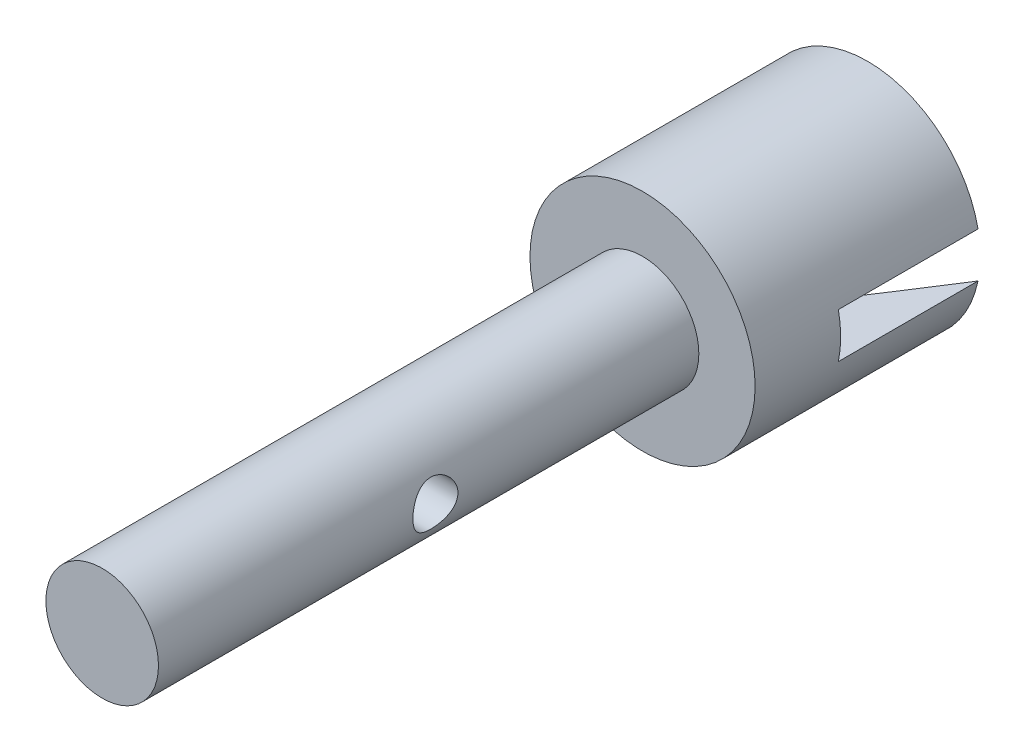
from build123d import *

# Parameters (mm, degrees)
SKETCH1_R           = 5
BOSS_EXTRUDE1_DEPTH = 10
SKETCH2_R           = 2.5
BOSS_EXTRUDE2_DEPTH = 24
SKETCH3_R           = 3
CUT_EXTRUDE1_DEPTH  = 5.2
CHAMFER1_SIZE       = 3.2
CHAMFER1_SIZE2      = 1.999581926
SKETCH7_W           = 12.152582876
SKETCH7_H           = 2
CUT_EXTRUDE2_DEPTH  = 6.2
CUT_EXTRUDE3_REACH  = 37.175
SKETCH8_R           = 1


with BuildPart() as part:
    # Sketch1 → Boss-Extrude1 (new body)
    with BuildSketch(Plane.XY):
        Circle(SKETCH1_R)
    extrude(amount=BOSS_EXTRUDE1_DEPTH)

    # Sketch2 → Boss-Extrude2 (add)
    with BuildSketch(Plane.XY.offset(10)):
        Circle(SKETCH2_R)
    extrude(amount=BOSS_EXTRUDE2_DEPTH)

    # Sketch3 → Cut-Extrude1 (cut)
    with BuildSketch(Plane(origin=(0, 0, 0), x_dir=(-1, 0, 0), z_dir=(0, 0, -1))):
        Circle(SKETCH3_R)
    extrude(amount=-CUT_EXTRUDE1_DEPTH, mode=Mode.SUBTRACT)

    # Chamfer1
    chamfer1_edges = [part.edges().sort_by_distance(p)[0] for p in [
        (3, 0, 0),
    ]]
    chamfer1_side = [part.faces().sort_by_distance(p)[0] for p in [
        (3, 0, 2.6),
    ]]
    chamfer(chamfer1_edges, length=CHAMFER1_SIZE, length2=CHAMFER1_SIZE2, reference=chamfer1_side[0])

    # Sketch6 → Cut-Revolve2 (revolve, cut)
    with BuildSketch(Plane(origin=(0, 0, 5.2), x_dir=(-1, 0, 0), z_dir=(0, 0, -1))):
        with BuildLine():
            Line((3, 0), (-3, 0))
            ThreePointArc((-3, 0), (0, -3), (3, 0))
        make_face()
    revolve(axis=Axis((-3, 0, 5.2), (1, 0, 0)), mode=Mode.SUBTRACT)

    # Sketch7 → Cut-Extrude2 (cut)
    with BuildSketch(Plane.XY):
        Rectangle(SKETCH7_W, SKETCH7_H)
    extrude(amount=CUT_EXTRUDE2_DEPTH, mode=Mode.SUBTRACT)

    # Sketch8 → Cut-Extrude3 (cut, up to next)
    with BuildSketch(Plane(origin=(2.5, 0, 0), x_dir=(0, 0, -1), z_dir=(1, 0, 0)), mode=Mode.PRIVATE) as cut_extrude3_sk1:
        with Locations((-21.7, 0)):
            Circle(SKETCH8_R)
    cut_extrude3_tool1 = extrude(cut_extrude3_sk1.sketch, amount=-CUT_EXTRUDE3_REACH, mode=Mode.PRIVATE) & part.part
    add(cut_extrude3_tool1.solids().sort_by_distance((2.5, 0, 21.7))[0], mode=Mode.SUBTRACT)


solid = part.part
